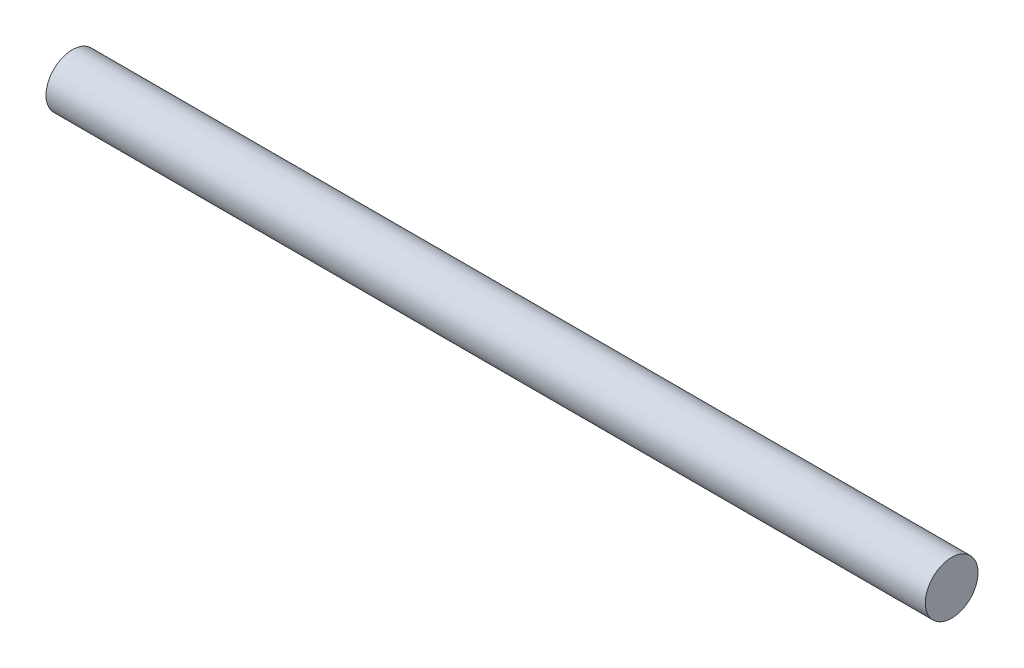
from build123d import *

# Parameters (mm, degrees)
SKETCH1_W = 76.2
SKETCH1_H = 2.286


with BuildPart() as part:
    # Sketch1 → Revolve1 (revolve)
    with BuildSketch(Plane.XY, mode=Mode.PRIVATE) as revolve1_sk:
        with Locations((-7.957450389, 1.143)):
            Rectangle(SKETCH1_W, SKETCH1_H)
    revolve(revolve1_sk.sketch.rotate(Axis((-46.057450389, 2.286, 0), (1, 0, 0)), 270), axis=Axis((-46.057450389, 2.286, 0), (1, 0, 0)))


solid = part.part
